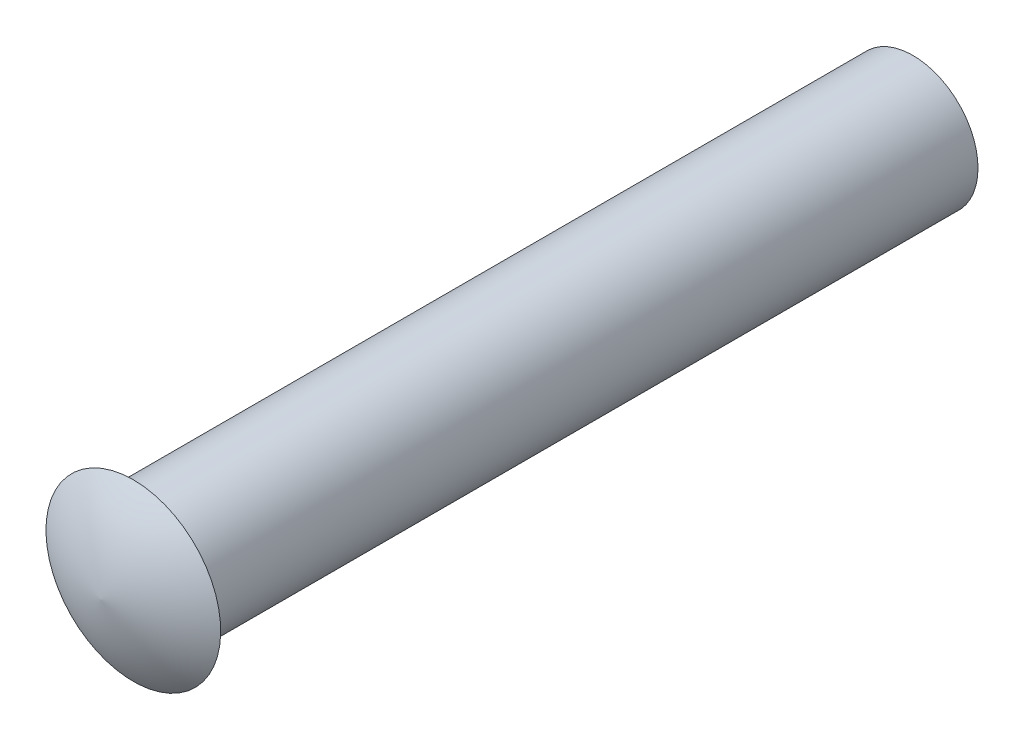
from build123d import *

# Parameters (mm, degrees)
SKETCH2_R           = 1.59
BOSS_EXTRUDE1_DEPTH = 19.05


with BuildPart() as part:
    # Sketch2 → Boss-Extrude1 (new body)
    with BuildSketch(Plane.XY):
        Circle(SKETCH2_R)
    extrude(amount=-BOSS_EXTRUDE1_DEPTH)

    # Sketch5 → Revolve1 (revolve)
    with BuildSketch(Plane(origin=(0, 0, 0), x_dir=(0, 0, -1), z_dir=(1, 0, 0))):
        with BuildLine():
            Line((0, 0), (-0.79, 0))
            ThreePointArc((-0.79, 0), (-0.532384277, 1.1183354), (0, 2.135))
            Line((0, 2.135), (0, 0))
        make_face()
    revolve(axis=Axis((0, 0, 0), (0, 0, 1)))


solid = part.part
